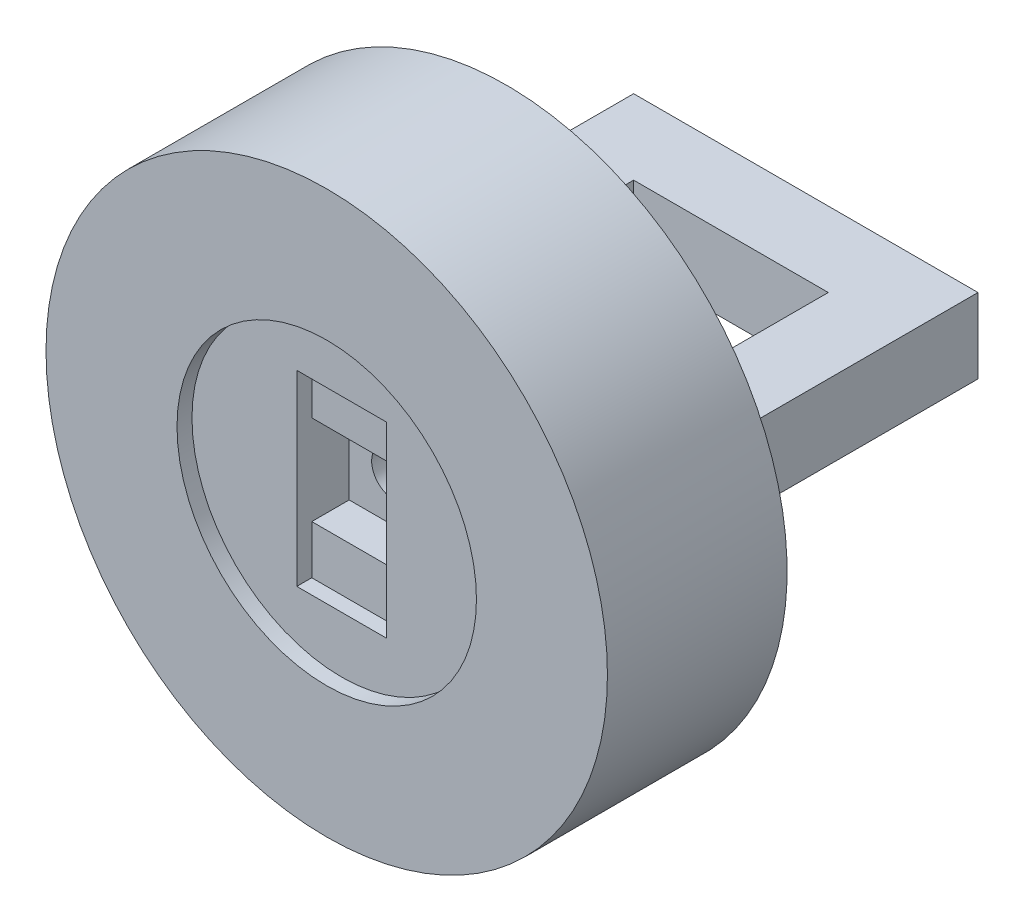
from build123d import *

# Parameters (mm, degrees)
SKETCH_1_R      = 37.5
SKETCH_1_R_2    = 3
EXTRUDE_1_DEPTH = 5
EXTRUDE_START   = 10
SKETCH_2_R      = 37.5
EXTRUDE_2_DEPTH = 10
SKETCH_4_R      = 37.5
SKETCH_4_W      = 12
SKETCH_4_H      = 12
EXTRUDE_3_DEPTH = 5
SKETCH_6_R      = 37.5
SKETCH_6_W      = 12
SKETCH_6_H      = 25
EXTRUDE_4_DEPTH = 2
SKETCH_11_R     = 37.5
SKETCH_11_R_2   = 20
EXTRUDE_6_DEPTH = 2
SKETCH_13_W     = 10
SKETCH_13_H     = 10
EXTRUDE_7_DEPTH = 30
SKETCH_14_W     = 46
SKETCH_14_H     = 10
EXTRUDE_8_DEPTH = 10


with BuildPart() as part:
    # Эскиз1 → Бобышка-Вытянуть1 (new body)
    with BuildSketch(Plane.XY):
        Circle(SKETCH_1_R)
        Circle(SKETCH_1_R_2, mode=Mode.SUBTRACT)
    extrude(amount=EXTRUDE_1_DEPTH)

    # Эскиз2 → Бобышка-Вытянуть2 (add)
    with BuildSketch(Plane(origin=(0, 0, 0), x_dir=(-1, 0, 0), z_dir=(0, 0, -1)).offset(EXTRUDE_START)):
        Circle(SKETCH_2_R)
    extrude(amount=-EXTRUDE_2_DEPTH)

    # Эскиз4 → Бобышка-Вытянуть3 (add)
    with BuildSketch(Plane.XY.offset(5)):
        with Locations(Location((0, 0, 0), (0, 0, 180))):
            Circle(SKETCH_4_R)
        Rectangle(SKETCH_4_W, SKETCH_4_H, mode=Mode.SUBTRACT)
    extrude(amount=EXTRUDE_3_DEPTH)

    # Эскиз6 → Бобышка-Вытянуть4 (add)
    with BuildSketch(Plane.XY.offset(10)):
        with Locations(Location((0, 0, 0), (0, 0, 180))):
            Circle(SKETCH_6_R)
        Rectangle(SKETCH_6_W, SKETCH_6_H, mode=Mode.SUBTRACT)
    extrude(amount=EXTRUDE_4_DEPTH)

    # Эскиз11 → Бобышка-Вытянуть6 (add)
    with BuildSketch(Plane.XY.offset(12)):
        with Locations(Location((0, 0, 0), (0, 0, 180))):
            Circle(SKETCH_11_R)
        Circle(SKETCH_11_R_2, mode=Mode.SUBTRACT)
    extrude(amount=EXTRUDE_6_DEPTH)

    # Эскиз13 → Бобышка-Вытянуть7 (add)
    with BuildSketch(Plane(origin=(0, 0, -10), x_dir=(-1, 0, 0), z_dir=(0, 0, -1))):
        with Locations((-18, 0)):
            Rectangle(SKETCH_13_W, SKETCH_13_H)
        with Locations((18, 0)):
            Rectangle(SKETCH_13_W, SKETCH_13_H)
    extrude(amount=EXTRUDE_7_DEPTH)

    # Эскиз14 → Бобышка-Вытянуть8 (add)
    with BuildSketch(Plane(origin=(0, 0, -40), x_dir=(-1, 0, 0), z_dir=(0, 0, -1))):
        Rectangle(SKETCH_14_W, SKETCH_14_H)
    extrude(amount=EXTRUDE_8_DEPTH)


solid = part.part
